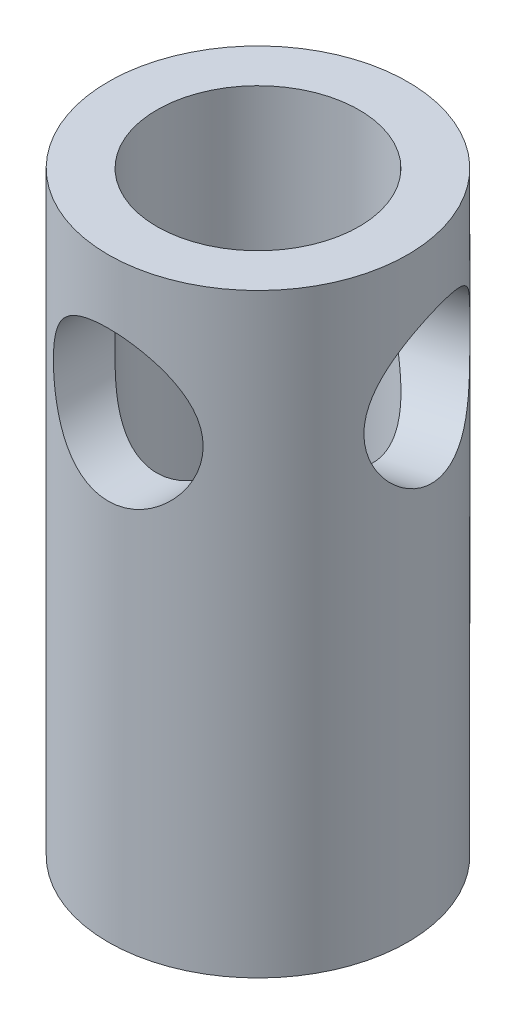
from build123d import *

# Parameters (mm, degrees)
SKETCH1_R           = 4
SKETCH1_R_2         = 2.7
BOSS_EXTRUDE1_DEPTH = 7.95
SKETCH2_R           = 2
CUT_EXTRUDE1_DEPTH  = 10.757176846
CIRPATTERN1_COUNT   = 2
CIRPATTERN1_ANGLE   = 105


with BuildPart() as part:
    # Sketch1 → Boss-Extrude1 (new, symmetric)
    with BuildSketch(Plane(origin=(0, 0, 0), x_dir=(1, 0, 0), z_dir=(0, 1, 0))):
        with Locations(Location((0, 0, 0), (0, 0, 270))):
            Circle(SKETCH1_R)
        with Locations(Location((0, 0, 0), (0, 0, 270))):
            Circle(SKETCH1_R_2, mode=Mode.SUBTRACT)
    extrude(amount=BOSS_EXTRUDE1_DEPTH, both=True)

    # Sketch2 → Cut-Extrude1 (cut, through all)
    with BuildSketch(Plane.XY):
        with Locations(Location((0, 4.25, 0), (0, 0, 90.000000002))):
            Circle(SKETCH2_R)
    cut_extrude1 = extrude(amount=CUT_EXTRUDE1_DEPTH, mode=Mode.SUBTRACT)

    # CirPattern1: Cut-Extrude1 ×2 about axis
    cirpattern1_axis = Axis((0, 7.95, 0), (0, 1, 0))
    for i in range(1, CIRPATTERN1_COUNT):
        add(cut_extrude1.rotate(cirpattern1_axis, i * CIRPATTERN1_ANGLE / (CIRPATTERN1_COUNT - 1)), mode=Mode.SUBTRACT)


solid = part.part
